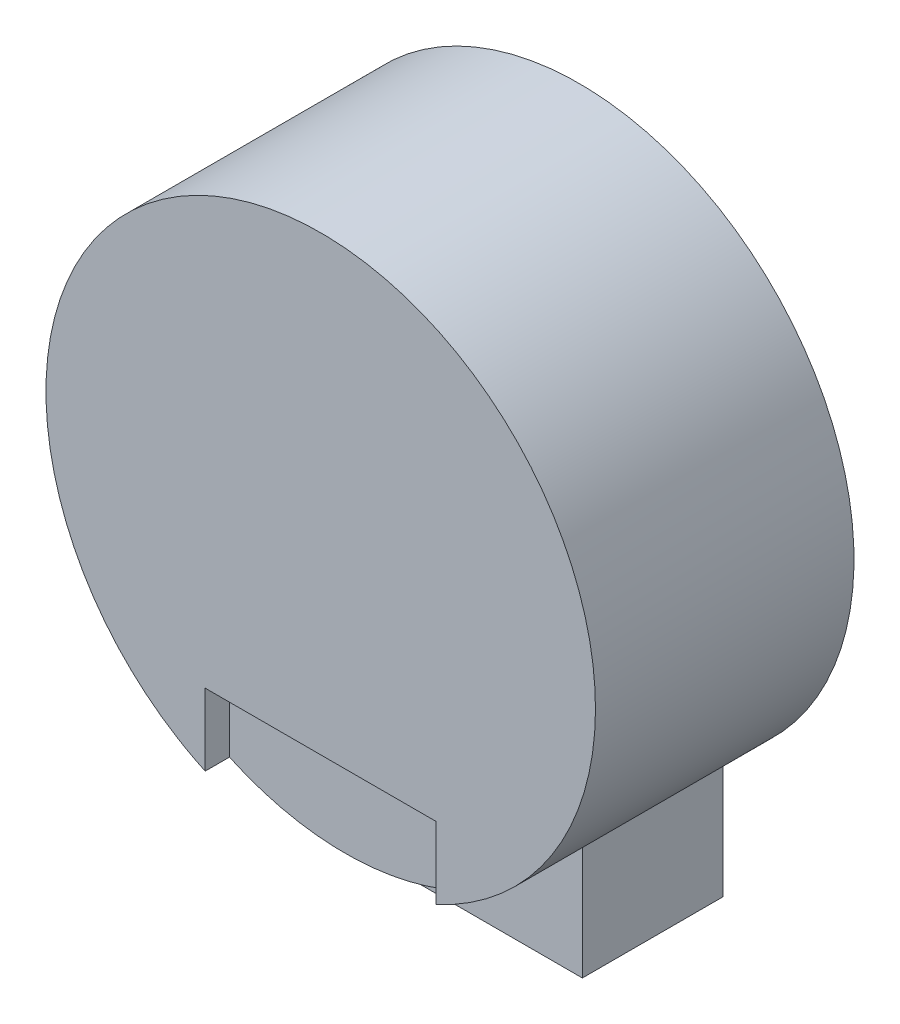
from build123d import *

# Parameters (mm, degrees)
P_IDAT_VYSUNUT_M1_DEPTH  = 2.25
SKICA2_W                 = 3.5
SKICA2_H                 = 0.5
ODEBRAT_VYSUNUT_M1_DEPTH = 3.289126928
SKICA3_R                 = 4.4
P_IDAT_VYSUNUT_M2_DEPTH  = 1.89
SKICA5_W                 = 3.7
SKICA5_H                 = 1.288072418
ODEBRAT_VYSUNUT_M2_DEPTH = 2.89


with BuildPart() as part:
    # Skica1 → Přidat vysunutím1 (new body)
    with BuildSketch(Plane.XY):
        with BuildLine():
            Line((-2.3, -3.750999867), (-2.3, -5.730999867))
            Line((-2.3, -5.730999867), (2.3, -5.730999867))
            Line((2.3, -5.730999867), (2.3, -3.750999867))
            ThreePointArc((2.3, -3.750999867), (0, 4.4), (-2.3, -3.750999867))
        make_face()
    extrude(amount=P_IDAT_VYSUNUT_M1_DEPTH)

    # Skica2 → Odebrat vysunutím1 (cut)
    with BuildSketch(Plane(origin=(0, -5.730999867, 0), x_dir=(-1, 0, 0), z_dir=(0, -1, 0))):
        with Locations((0, -0.95)):
            Rectangle(SKICA2_W, SKICA2_H)
    extrude(amount=-ODEBRAT_VYSUNUT_M1_DEPTH, mode=Mode.SUBTRACT)

    # Skica3 → Přidat vysunutím2 (add)
    with BuildSketch(Plane.XY.offset(2.25)):
        with Locations(Location((0, 0, 0), (0, 0, 238.484629998))):
            Circle(SKICA3_R)
    extrude(amount=P_IDAT_VYSUNUT_M2_DEPTH)

    # Skica5 → Odebrat vysunutím2 (cut)
    with BuildSketch(Plane(origin=(0, -5.730999867, 0), x_dir=(-1, 0, 0), z_dir=(0, -1, 0))):
        with Locations((0, -4.395369221)):
            Rectangle(SKICA5_W, SKICA5_H)
    extrude(amount=-ODEBRAT_VYSUNUT_M2_DEPTH, mode=Mode.SUBTRACT)


solid = part.part
